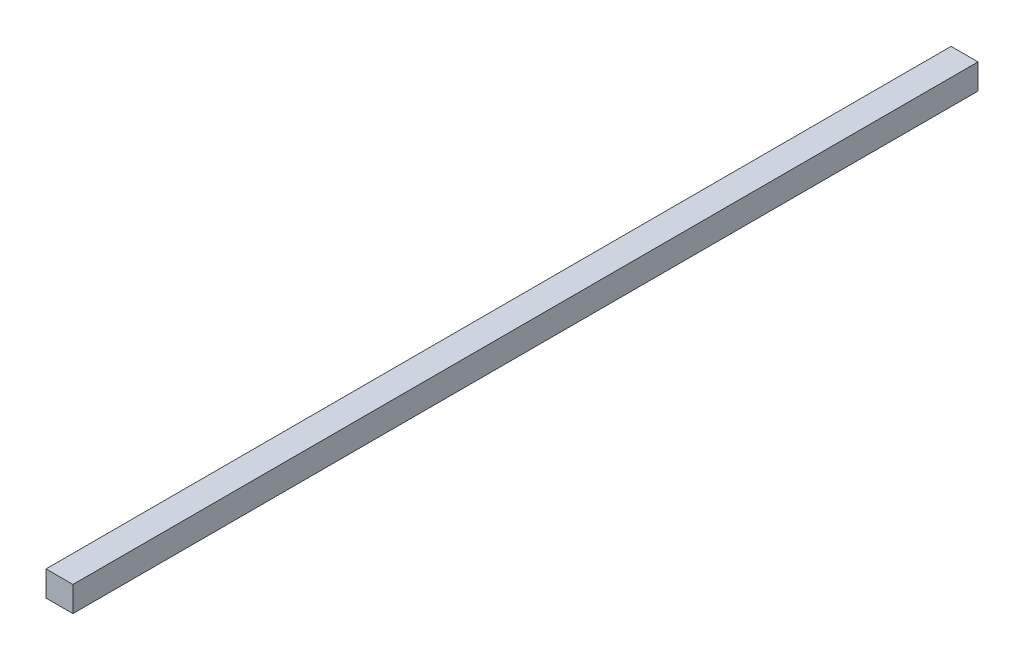
from build123d import *

# Parameters (mm, degrees)
SKETCH1_W           = 50
SKETCH1_H           = 47
BOSS_EXTRUDE1_DEPTH = 1682


with BuildPart() as part:
    # Sketch1 → Boss-Extrude1 (new body)
    with BuildSketch(Plane.XY):
        with Locations((-8.766233766, -5.642857143)):
            Rectangle(SKETCH1_W, SKETCH1_H)
    extrude(amount=BOSS_EXTRUDE1_DEPTH)


solid = part.part
